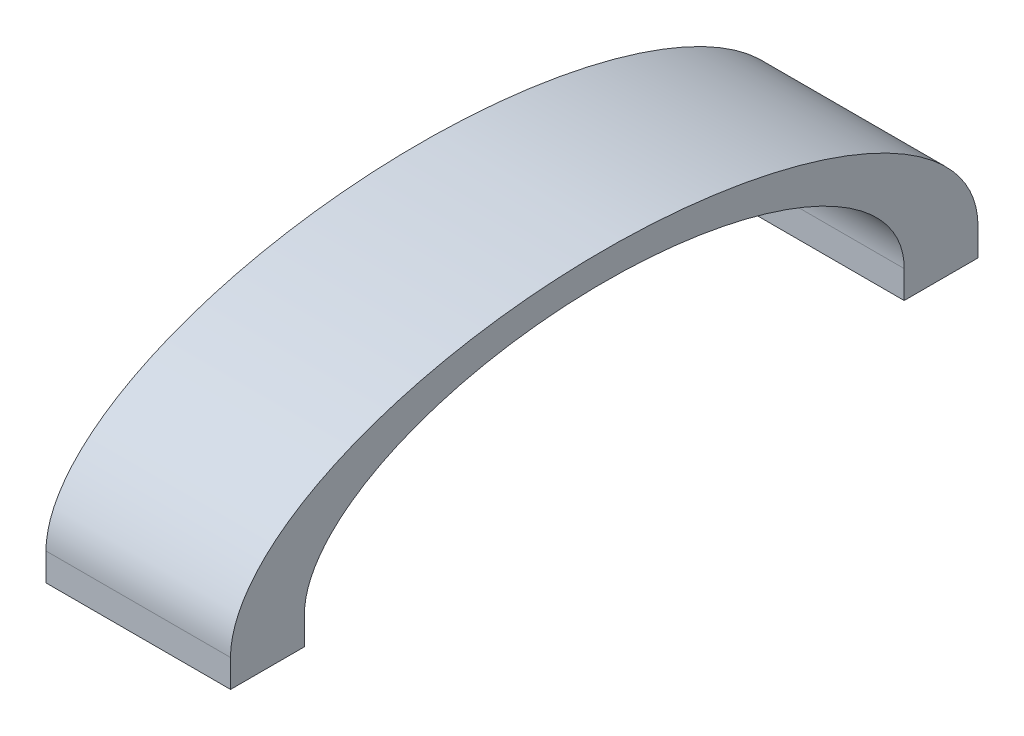
from build123d import *

# Parameters (mm, degrees)
MAIN_DEPTH             = 10
SKETCH4_W              = 20
SKETCH4_H              = 8
INSERT_EXTENSION_DEPTH = 3
SKETCH5_R              = 2.1
INSERT_HOLE_DEPTH      = 5.7


with BuildPart() as part:
    # Sketch2 → Main (new, symmetric)
    with BuildSketch(Plane(origin=(0, 0, 0), x_dir=(0, 0, -1), z_dir=(1, 0, 0))):
        with BuildLine():
            Line((32.5, 0), (40.5, 0))
            add(Edge.make_bspline(
                [(40.5, 0), (40.5, 18), (0, 18)],
                knots=[0, 0, 0, 1.570796327, 1.570796327, 1.570796327], degree=2, weights=[1, 0.707106781, 1]))
            Line((0, 18), (0, 15))
            add(Edge.make_bspline(
                [(32.5, 0), (32.5, 15), (0, 15)],
                knots=[3.141592654, 3.141592654, 3.141592654, 4.71238898, 4.71238898, 4.71238898], degree=2, weights=[1, 0.707106781, 1]))
        make_face()
    main = extrude(amount=MAIN_DEPTH, both=True)

    # Sketch4 → Insert extension (add)
    with BuildSketch(Plane.XZ):
        with Locations((0, -36.5)):
            Rectangle(SKETCH4_W, SKETCH4_H)
    insert_extension = extrude(amount=INSERT_EXTENSION_DEPTH)

    # Sketch5 → Insert hole (cut)
    with BuildSketch(Plane.XZ.offset(3)):
        with Locations(Location((0, -36.5, 0), (0, 0, 270))):
            Circle(SKETCH5_R)
    insert_hole = extrude(amount=-INSERT_HOLE_DEPTH, mode=Mode.SUBTRACT)

    # Mirror1: Main, Insert extension, Insert hole across plane
    add(main.mirror(Plane(origin=(10, 15, 0), x_dir=(1, 0, 0), z_dir=(0, 0, -1))))
    add(insert_extension.mirror(Plane(origin=(10, 15, 0), x_dir=(1, 0, 0), z_dir=(0, 0, -1))))
    add(insert_hole.mirror(Plane(origin=(10, 15, 0), x_dir=(1, 0, 0), z_dir=(0, 0, -1))), mode=Mode.SUBTRACT)


solid = part.part
